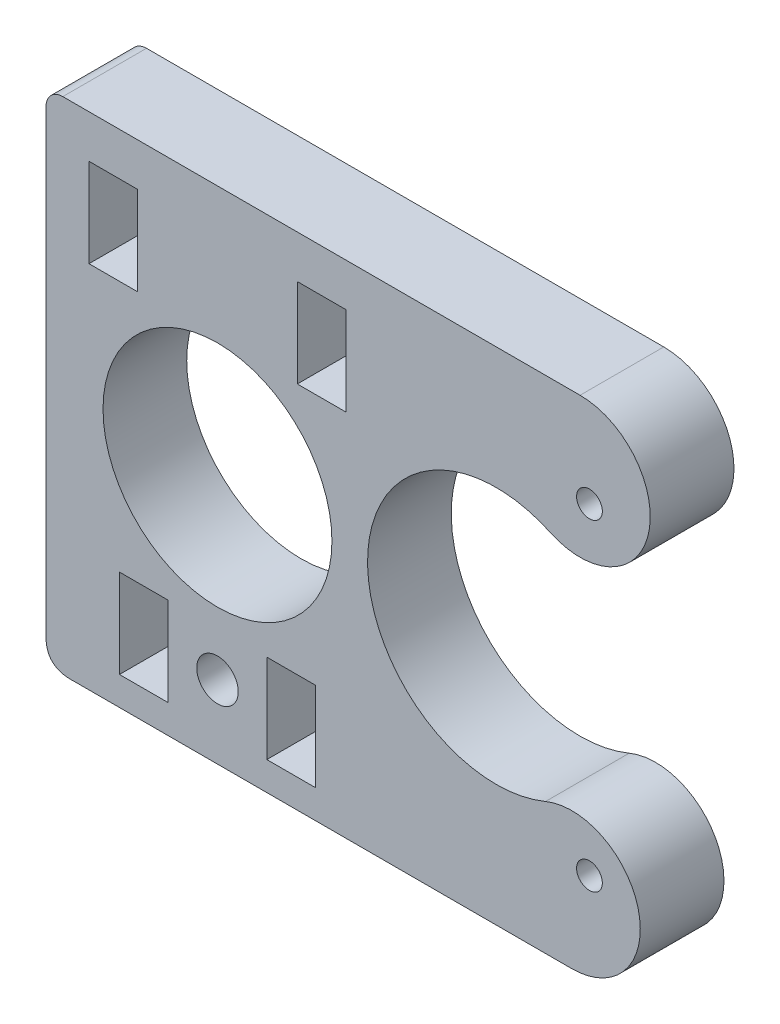
from build123d import *

# Parameters (mm, degrees)
SKETCH1_R           = 0.899918091
SKETCH1_R_2         = 0.899925125
SKETCH1_R_3         = 1.45
SKETCH1_R_4         = 8
SKETCH1_W           = 3.400011
SKETCH1_H           = 6.2
SKETCH1_W_2         = 3.4
BOSS_EXTRUDE2_DEPTH = 5.85


with BuildPart() as part:
    # Sketch1 → Boss-Extrude2 (new body)
    with BuildSketch(Plane.XY):
        with BuildLine():
            Line((669.21684417, 349.14615334), (647.916445931, 349.14615334))
            ThreePointArc((647.916445931, 349.14615334), (647.089176563, 348.803487148), (646.746510371, 347.976217781))
            Line((646.746510371, 347.976217781), (646.746510371, 315.835342781))
            add(Edge.make_bspline(
                [(646.746510371, 315.835342781), (646.746510371, 314.02716752), (648.773268796, 314.14615334)],
                knots=[0, 0, 0, 1, 1, 1], degree=2))
            Line((648.773268796, 314.14615334), (669.21684417, 314.14615334))
            Line((669.21684417, 314.14615334), (683.493527466, 314.14615334))
            ThreePointArc((683.493527466, 314.14615334), (688.18557682, 319.867900287), (681.655729571, 323.348533873))
            ThreePointArc((681.655729571, 323.348533873), (669.218799175, 331.833597772), (681.99878285, 339.792590441))
            ThreePointArc((681.99878285, 339.792590441), (688.860665305, 343.178948939), (684.070537296, 349.14615334))
            Line((684.070537296, 349.14615334), (669.21684417, 349.14615334))
        make_face()
        with Locations((684.726521371, 342.89615334)):
            Circle(SKETCH1_R, mode=Mode.SUBTRACT)
        with Locations((684.726521371, 320.39615334)):
            Circle(SKETCH1_R_2, mode=Mode.SUBTRACT)
        with Locations((658.726521371, 319.24615334)):
            Circle(SKETCH1_R_3, mode=Mode.SUBTRACT)
        with Locations((658.726521371, 331.64615334)):
            Circle(SKETCH1_R_4, mode=Mode.SUBTRACT)
        with Locations((651.446515871, 343.04615334)):
            Rectangle(SKETCH1_W, SKETCH1_H, mode=Mode.SUBTRACT)
        with Locations((653.576521371, 319.24615334)):
            Rectangle(SKETCH1_W_2, SKETCH1_H, mode=Mode.SUBTRACT)
        with Locations((666.006526871, 343.04615334)):
            Rectangle(SKETCH1_W, SKETCH1_H, mode=Mode.SUBTRACT)
        with Locations((663.876521371, 319.24615334)):
            Rectangle(SKETCH1_W_2, SKETCH1_H, mode=Mode.SUBTRACT)
    extrude(amount=BOSS_EXTRUDE2_DEPTH)


solid = part.part
